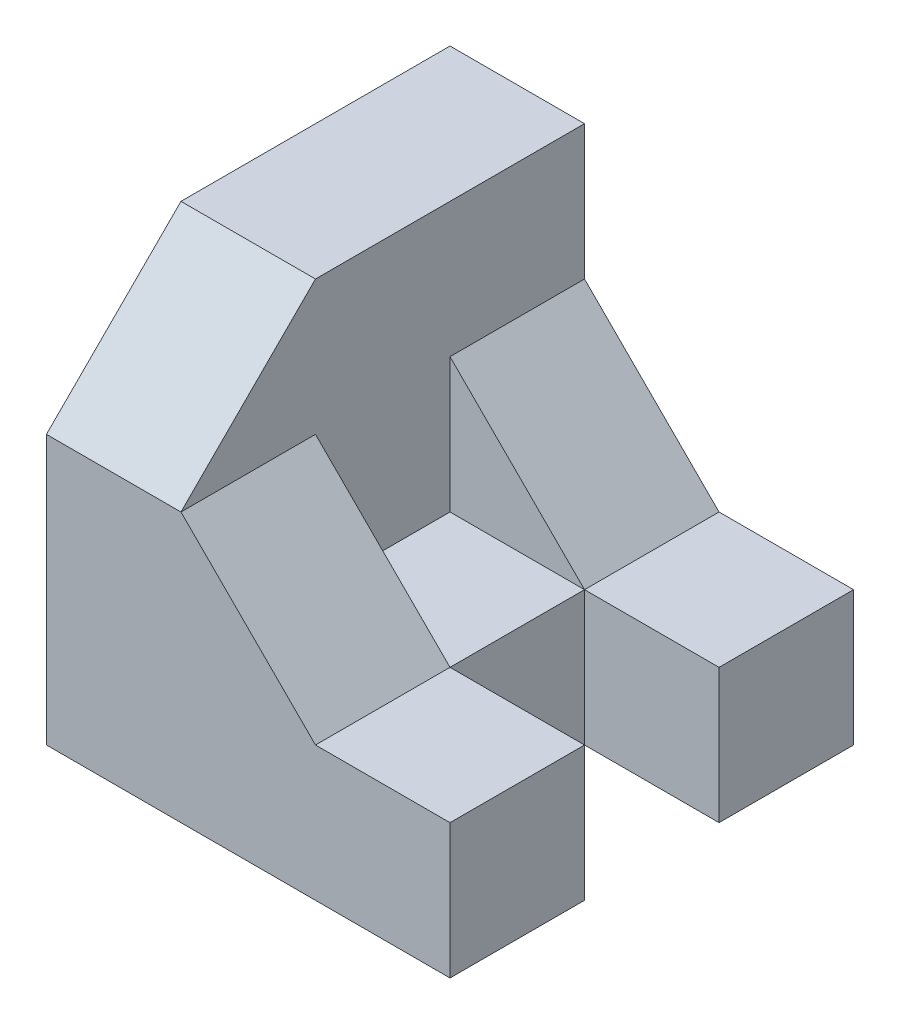
from build123d import *

# Parameters (mm, degrees)
CROQUIS1_W              = 60
CROQUIS1_H              = 60
SALIENTE_EXTRUIR1_DEPTH = 60
CROQUIS2_W              = 40
CROQUIS2_H              = 20
CORTAR_EXTRUIR1_DEPTH   = 60
CROQUIS3_W              = 20
CROQUIS3_H              = 20
SALIENTE_EXTRUIR2_DEPTH = 20
CORTAR_EXTRUIR2_DEPTH   = 20
CORTAR_EXTRUIR3_DEPTH   = 20
CORTAR_EXTRUIR4_DEPTH   = 20
CROQUIS7_W              = 20
CROQUIS7_H              = 20
CORTAR_EXTRUIR5_DEPTH   = 40
CROQUIS9_W              = 20
CROQUIS9_H              = 20
CORTAR_EXTRUIR6_DEPTH   = 40


with BuildPart() as part:
    # Croquis1 → Saliente-Extruir1 (new body)
    with BuildSketch(Plane.XY):
        with Locations((30, 30)):
            Rectangle(CROQUIS1_W, CROQUIS1_H)
    extrude(amount=-SALIENTE_EXTRUIR1_DEPTH)

    # Croquis2 → Cortar-Extruir1 (cut)
    with BuildSketch(Plane(origin=(0, 60, 0), x_dir=(1, 0, 0), z_dir=(0, 1, 0))):
        with Locations((40, 30)):
            Rectangle(CROQUIS2_W, CROQUIS2_H)
    extrude(amount=-CORTAR_EXTRUIR1_DEPTH, mode=Mode.SUBTRACT)

    # Croquis3 → Saliente-Extruir2 (add)
    with BuildSketch(Plane.XY.offset(-40)):
        with Locations((30, 10)):
            Rectangle(CROQUIS3_W, CROQUIS3_H)
    extrude(amount=SALIENTE_EXTRUIR2_DEPTH)

    # Croquis4 → Cortar-Extruir2 (cut)
    with BuildSketch(Plane.XY.offset(-40)):
        Polygon((20, 40), (40, 20), (40, 60), (20, 60), align=None)
    extrude(amount=-CORTAR_EXTRUIR2_DEPTH, mode=Mode.SUBTRACT)

    # Croquis5 → Cortar-Extruir3 (cut)
    with BuildSketch(Plane(origin=(0, 0, -20), x_dir=(-1, 0, 0), z_dir=(0, 0, -1))):
        Polygon((-40, 20), (-40, 60), (-20, 60), (-20, 40), align=None)
    extrude(amount=-CORTAR_EXTRUIR3_DEPTH, mode=Mode.SUBTRACT)

    # Croquis6 → Cortar-Extruir4 (cut)
    with BuildSketch(Plane(origin=(20, 0, 0), x_dir=(0, 0, -1), z_dir=(1, 0, 0))):
        Polygon((0, 40), (20, 60), (0, 60), align=None)
    extrude(amount=-CORTAR_EXTRUIR4_DEPTH, mode=Mode.SUBTRACT)

    # Croquis7 → Cortar-Extruir5 (cut)
    with BuildSketch(Plane(origin=(0, 60, 0), x_dir=(1, 0, 0), z_dir=(0, 1, 0))):
        with Locations((50, 50)):
            Rectangle(CROQUIS7_W, CROQUIS7_H)
    extrude(amount=-CORTAR_EXTRUIR5_DEPTH, mode=Mode.SUBTRACT)

    # Croquis9 → Cortar-Extruir6 (cut)
    with BuildSketch(Plane(origin=(0, 60, 0), x_dir=(1, 0, 0), z_dir=(0, 1, 0))):
        with Locations((50, 10)):
            Rectangle(CROQUIS9_W, CROQUIS9_H)
    extrude(amount=-CORTAR_EXTRUIR6_DEPTH, mode=Mode.SUBTRACT)


solid = part.part
